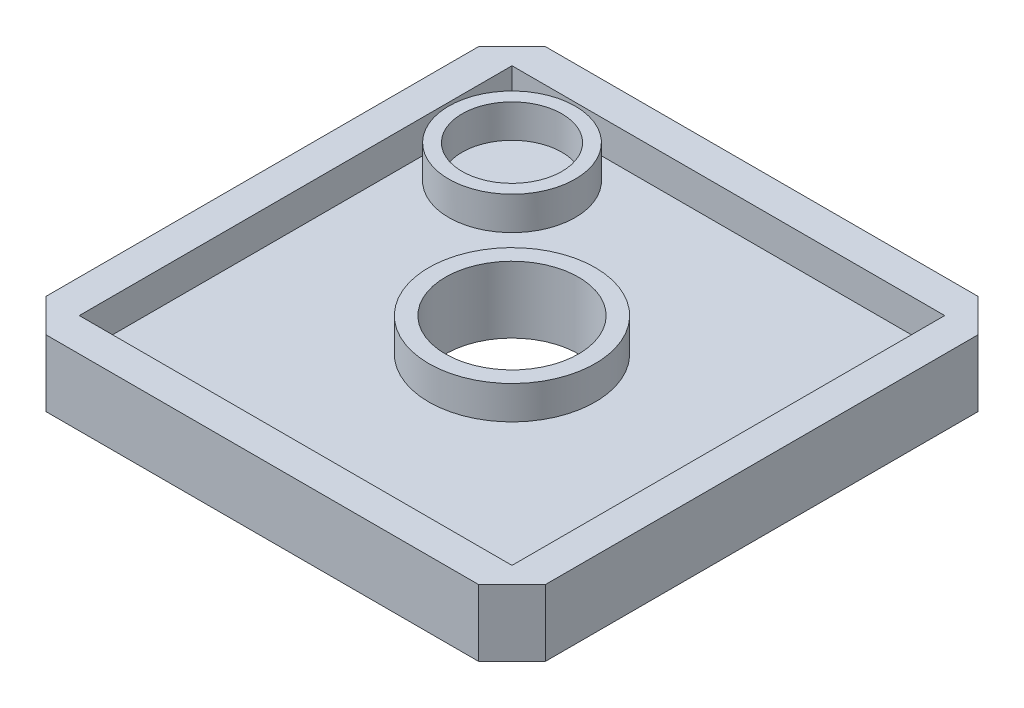
from build123d import *

# Parameters (mm, degrees)
SKETCH1_W           = 150
SKETCH1_H           = 150
SKETCH1_W_2         = 130
SKETCH1_H_2         = 130
BOSS_EXTRUDE2_DEPTH = 20
SKETCH1_4_W         = 130
SKETCH1_4_H         = 130
BOSS_EXTRUDE3_DEPTH = 10
CHAMFER1_SIZE       = 10
SKETCH2_R           = 20
CUT_EXTRUDE2_DEPTH  = 10
BOSS_EXTRUDE4_START = 10
SKETCH3_R           = 25
SKETCH3_R_2         = 20
BOSS_EXTRUDE4_DEPTH = 10
SKETCH4_R           = 19
SKETCH4_R_2         = 15
BOSS_EXTRUDE5_DEPTH = 10


with BuildPart() as part:
    # Sketch1 → Boss-Extrude2 (new body)
    with BuildSketch(Plane(origin=(0, 0, 0), x_dir=(1, 0, 0), z_dir=(0, 1, 0))):
        Rectangle(SKETCH1_W, SKETCH1_H)
        Rectangle(SKETCH1_W_2, SKETCH1_H_2, mode=Mode.SUBTRACT)
    extrude(amount=BOSS_EXTRUDE2_DEPTH)

    # Sketch1<4> → Boss-Extrude3 (add)
    with BuildSketch(Plane(origin=(0, 0, 0), x_dir=(1, 0, 0), z_dir=(0, 1, 0))):
        Rectangle(SKETCH1_4_W, SKETCH1_4_H)
    extrude(amount=BOSS_EXTRUDE3_DEPTH)

    # Chamfer1
    chamfer1_edges = [part.edges().sort_by_distance(p)[0] for p in [
        (75, 10, 75),
        (-75, 10, 75),
        (-75, 10, -75),
        (75, 10, -75),
    ]]
    chamfer(chamfer1_edges, length=CHAMFER1_SIZE)

    # Sketch2 → Cut-Extrude2 (cut)
    with BuildSketch(Plane(origin=(0, 10, 0), x_dir=(1, 0, 0), z_dir=(0, 1, 0))):
        with Locations(Location((0, 0, 0), (0, 0, 270))):
            Circle(SKETCH2_R)
    extrude(amount=-CUT_EXTRUDE2_DEPTH, mode=Mode.SUBTRACT)

    # Sketch3 → Boss-Extrude4 (add)
    with BuildSketch(Plane(origin=(0, 10, 0), x_dir=(1, 0, 0), z_dir=(0, 1, 0)).offset(BOSS_EXTRUDE4_START)):
        with Locations(Location((0, 0, 0), (0, 0, 270))):
            Circle(SKETCH3_R)
        with Locations(Location((0, 0, 0), (0, 0, 270))):
            Circle(SKETCH3_R_2, mode=Mode.SUBTRACT)
    extrude(amount=-BOSS_EXTRUDE4_DEPTH)

    # Sketch4 → Boss-Extrude5 (add)
    with BuildSketch(Plane(origin=(0, 10, 0), x_dir=(1, 0, 0), z_dir=(0, 1, 0))):
        with Locations(Location((-45, 45, 0), (0, 0, 90))):
            Circle(SKETCH4_R)
        with Locations(Location((-45, 45, 0), (0, 0, 90))):
            Circle(SKETCH4_R_2, mode=Mode.SUBTRACT)
    extrude(amount=BOSS_EXTRUDE5_DEPTH)


solid = part.part
